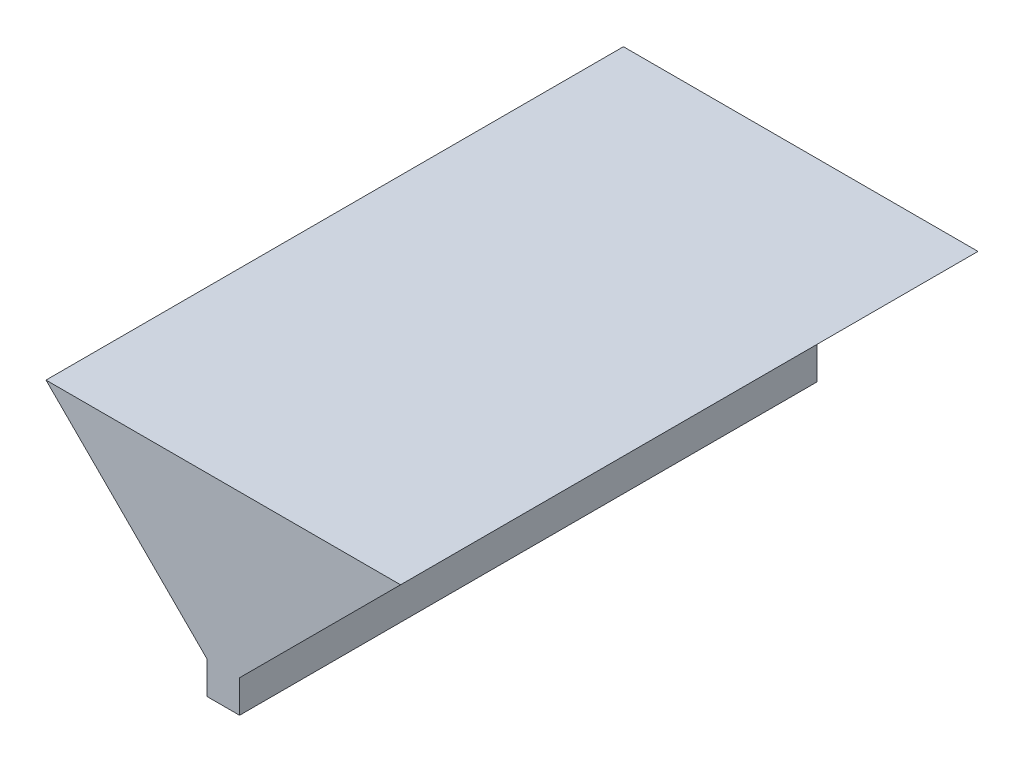
from build123d import *

# Parameters (mm, degrees)
BOSS_EXTRUDE1_DEPTH = 35.5


with BuildPart() as part:
    # Sketch1 → Boss-Extrude1 (new body)
    with BuildSketch(Plane.XY):
        Polygon((0, 0), (0, 2), (-9.899494937, 11.899494937), (11.899494937, 11.899494937), (2, 2), (2, 0), align=None)
    extrude(amount=BOSS_EXTRUDE1_DEPTH)


solid = part.part
